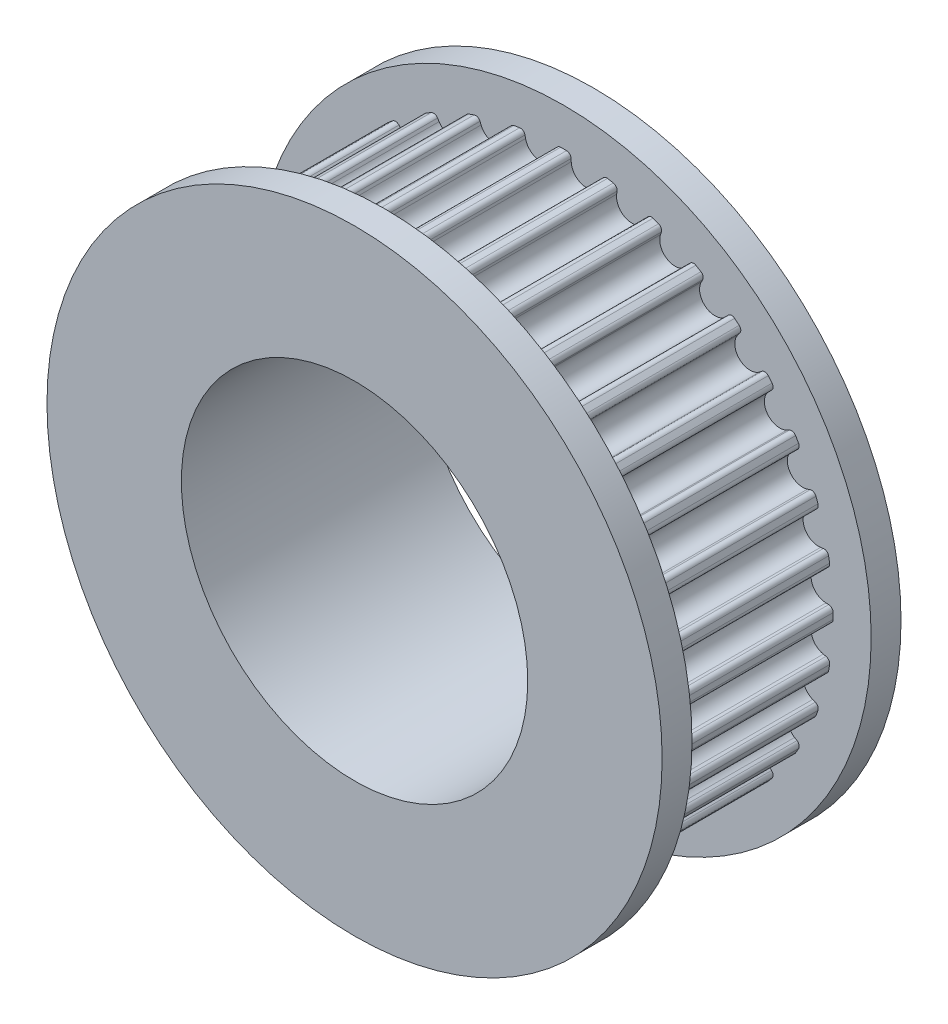
from build123d import *

# Parameters (mm, degrees)
SKETCH2_R         = 45.15
EXTRUDE1_DEPTH    = 15
EXTRUDE2_DEPTH    = 71.54817503
CIRPATTERN1_COUNT = 36
SKETCH3_R         = 51.5
EXTRUDE3_DEPTH    = 5
EXTRUDE4_START    = 5
SKETCH4_R         = 51.5
EXTRUDE4_DEPTH    = 5
SKETCH5_R         = 29
EXTRUDE5_DEPTH    = 84.093321031


with BuildPart() as part:
    # Sketch2 → Extrude1 (new, symmetric)
    with BuildSketch(Plane.XY):
        Circle(SKETCH2_R)
    extrude(amount=EXTRUDE1_DEPTH, both=True)

    # Sketch1 → Extrude2 (cut, through all)
    with BuildSketch(Plane.XY.offset(15)):
        with BuildLine():
            Line((-1.265610805, 44.394558923), (-1.282106289, 43.922190055))
            ThreePointArc((-1.282106289, 43.922190055), (-3.626550456, 41.451661388), (-6.364380048, 43.477548716))
            Line((-6.364380048, 43.477548716), (-6.462650922, 43.939876828))
            ThreePointArc((-6.462650922, 43.939876828), (-6.785899963, 44.421956093), (-7.352628199, 44.547293504))
            ThreePointArc((-7.352628199, 44.547293504), (-3.935081785, 44.978190619), (-0.494631081, 45.147290507))
            ThreePointArc((-0.494631081, 45.147290507), (-1.030984829, 44.925445927), (-1.265610805, 44.394558923))
        make_face()
    extrude2 = extrude(amount=-EXTRUDE2_DEPTH, mode=Mode.SUBTRACT)

    # CirPattern1: Extrude2 ×36 about axis
    cirpattern1_axis = Axis((0, 0, 0), (0, 0, 1))
    for i in range(1, CIRPATTERN1_COUNT):
        add(extrude2.rotate(cirpattern1_axis, i * 360 / CIRPATTERN1_COUNT), mode=Mode.SUBTRACT)

    # Sketch3 → Extrude3 (add)
    with BuildSketch(Plane(origin=(0, 0, -15), x_dir=(-1, 0, 0), z_dir=(0, 0, -1))):
        Circle(SKETCH3_R)
    extrude(amount=EXTRUDE3_DEPTH)

    # Sketch4 → Extrude4 (add)
    with BuildSketch(Plane.XY.offset(15).offset(EXTRUDE4_START)):
        with Locations(Location((0, 0, 0), (0, 0, 180))):
            Circle(SKETCH4_R)
    extrude(amount=-EXTRUDE4_DEPTH)

    # Sketch5 → Extrude5 (cut, through all)
    with BuildSketch(Plane.XY.offset(20)):
        Circle(SKETCH5_R)
    extrude(amount=-EXTRUDE5_DEPTH, mode=Mode.SUBTRACT)


solid = part.part
